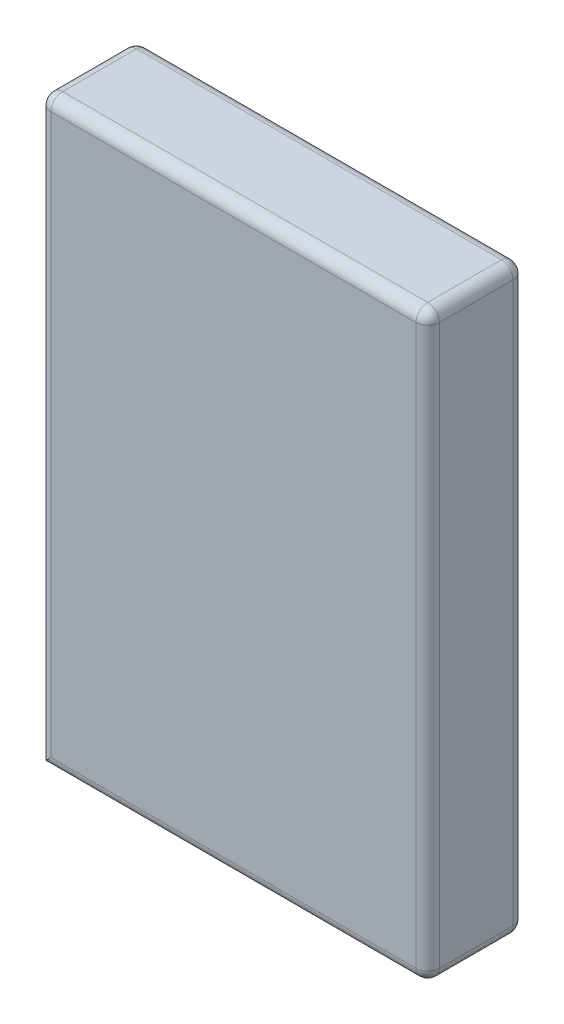
from build123d import *

# Parameters (mm, degrees)
SKETCH1_W           = 25.4
SKETCH1_H           = 38.1
BOSS_EXTRUDE1_DEPTH = 6.35
FILLET1_R           = 0.762


with BuildPart() as part:
    # Sketch1 → Boss-Extrude1 (new body)
    with BuildSketch(Plane.XY):
        Rectangle(SKETCH1_W, SKETCH1_H)
    extrude(amount=BOSS_EXTRUDE1_DEPTH)

    # Fillet1
    fillet1_edges = [part.edges().sort_by_distance(p)[0] for p in [
        (12.7, 0, 6.35),
        (0, 19.05, 6.35),
        (-12.7, 0, 6.35),
        (0, 19.05, 0),
        (12.7, 0, 0),
        (0, -19.05, 0),
        (-12.7, 0, 0),
        (0, -19.05, 6.35),
        (-12.7, 19.05, 3.175),
        (12.7, 19.05, 3.175),
        (12.7, -19.05, 3.175),
    ]]
    fillet(fillet1_edges, radius=FILLET1_R)


solid = part.part
